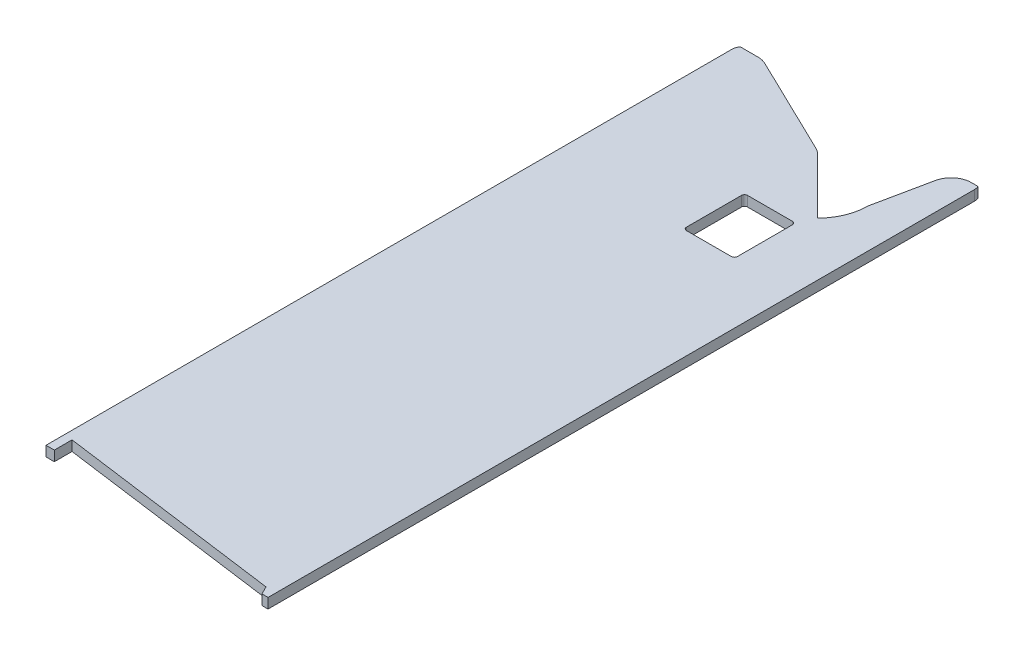
from build123d import *

# Parameters (mm, degrees)
SKETCH1_W           = 609.6
SKETCH1_H           = 1828.8
BOSS_EXTRUDE1_DEPTH = 25.4
FILLET1_R           = 25.4
CUT_EXTRUDE2_DEPTH  = 965.196847122
CUT_EXTRUDE3_DEPTH  = 965.196847122
CUT_EXTRUDE4_DEPTH  = 956.204611857


with BuildPart() as part:
    # Sketch1 → Boss-Extrude1 (new body)
    with BuildSketch(Plane(origin=(0, 0, 0), x_dir=(1, 0, 0), z_dir=(0, 1, 0))):
        Rectangle(SKETCH1_W, SKETCH1_H)
    extrude(amount=BOSS_EXTRUDE1_DEPTH)

    # Fillet1
    fillet1_edges = [part.edges().sort_by_distance(p)[0] for p in [
        (-304.8, 12.7, -914.4),
        (304.8, 12.7, -914.4),
        (304.8, 12.7, 914.4),
        (-304.8, 12.7, 914.4),
    ]]
    fillet(fillet1_edges, radius=FILLET1_R)

    # Sketch3 → Cut-Extrude2 (cut, through all)
    with BuildSketch(Plane(origin=(0, 25.4, 0), x_dir=(1, 0, 0), z_dir=(0, 1, 0))):
        with BuildLine():
            Line((16.251587569, 779.193092163), (-233.147514188, 899.843092163))
            ThreePointArc((-233.147514188, 899.843092163), (-243.921993823, 903.629350189), (-255.27, 904.913062406))
            Line((-255.27, 904.913062406), (-323.85, 904.913062406))
            Line((-323.85, 904.913062406), (-323.85, 931.593092163))
            Line((-323.85, 931.593092163), (311.15, 931.593092163))
            Line((311.15, 931.593092163), (311.15, 899.843092163))
            Line((311.15, 899.843092163), (285.75, 899.843092163))
            ThreePointArc((285.75, 899.843092163), (253.698373918, 888.455441312), (236.016540238, 859.397945134))
            Line((236.016540238, 859.397945134), (207.824095772, 723.992082179))
            ThreePointArc((207.824095772, 723.992082179), (207.109723344, 719.608512763), (206.78096626, 715.179299789))
            ThreePointArc((206.78096626, 715.179299789), (196.558100486, 668.783623502), (170.129901322, 629.30431181))
            Line((170.129901322, 629.30431181), (30.050126241, 769.384086891))
            ThreePointArc((30.050126241, 769.384086891), (23.562355365, 774.867453261), (16.251587569, 779.193092163))
        make_face()
    extrude(amount=-CUT_EXTRUDE2_DEPTH, mode=Mode.SUBTRACT)

    # Sketch4 → Cut-Extrude3 (cut, through all)
    with BuildSketch(Plane(origin=(0, 25.4, 0), x_dir=(1, 0, 0), z_dir=(0, 1, 0))):
        Polygon((-327.069996122, -833.12), (-283.889996122, -833.12), (-283.889996122, -788.67), (279.4, -864.87), (289.56, -885.19), (330.2, -885.19), (330.2, -946.15), (-327.069996122, -946.15), align=None)
    extrude(amount=-CUT_EXTRUDE3_DEPTH, mode=Mode.SUBTRACT)

    # Sketch5 → Cut-Extrude4 (cut, through all)
    with BuildSketch(Plane.XZ):
        with BuildLine():
            Line((152.843358649, -583.374519212), (152.843358649, -445.325480788))
            add(Edge.make_bspline(
                [(152.843358649, -445.325480788), (152.843358649, -437.706641351), (145.224519212, -437.706641351)],
                knots=[2.356346783, 2.356346783, 2.356346783, 3.926838524, 3.926838524, 3.926838524], degree=2, weights=[1, 0.707214461, 1]))
            Line((145.224519212, -437.706641351), (32.575480788, -437.706641351))
            add(Edge.make_bspline(
                [(32.575480788, -437.706641351), (24.956641351, -437.706641351), (24.956641351, -445.325480788)],
                knots=[2.356346783, 2.356346783, 2.356346783, 3.926838524, 3.926838524, 3.926838524], degree=2, weights=[1, 0.707214461, 1]))
            Line((24.956641351, -445.325480788), (24.956641351, -583.374519212))
            add(Edge.make_bspline(
                [(24.956641351, -583.374519212), (24.956641351, -590.993358649), (32.575480788, -590.993358649)],
                knots=[2.356346783, 2.356346783, 2.356346783, 3.926838524, 3.926838524, 3.926838524], degree=2, weights=[1, 0.707214461, 1]))
            Line((32.575480788, -590.993358649), (145.224519212, -590.993358649))
            add(Edge.make_bspline(
                [(145.224519212, -590.993358649), (152.843358649, -590.993358649), (152.843358649, -583.374519212)],
                knots=[2.356346783, 2.356346783, 2.356346783, 3.926838524, 3.926838524, 3.926838524], degree=2, weights=[1, 0.707214461, 1]))
        make_face()
    extrude(amount=-CUT_EXTRUDE4_DEPTH, mode=Mode.SUBTRACT)


solid = part.part
